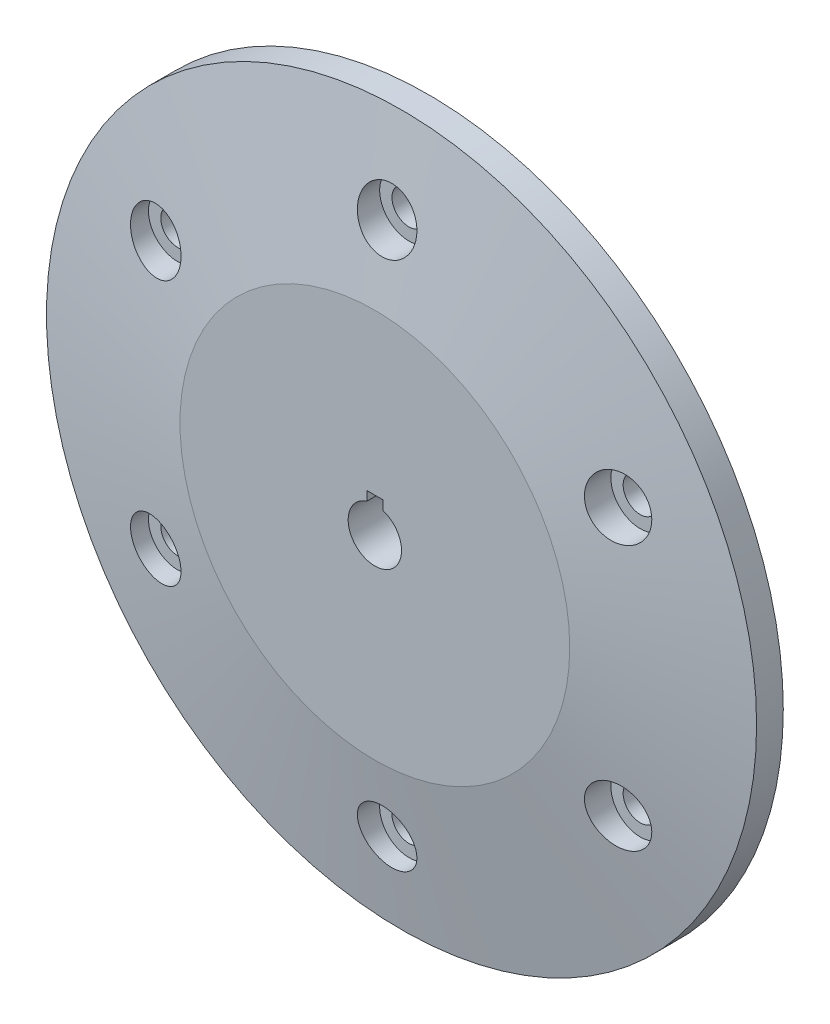
from build123d import *

# Parameters (mm, degrees)
CUT_EXTRUDE1_DEPTH                                  = 99.714234029
CHAMFER2_SIZE                                       = 5
CHAMFER2_SIZE2                                      = 30
CBORE_FOR_M6_HEX_SOCKET_HEAD_CAP_SCREW1_D           = 6.4
CBORE_FOR_M6_HEX_SOCKET_HEAD_CAP_SCREW1_CBORE_D     = 11
CBORE_FOR_M6_HEX_SOCKET_HEAD_CAP_SCREW1_CBORE_DEPTH = 6.4
CIRPATTERN1_COUNT                                   = 6


with BuildPart() as part:
    # Sketch1 → Revolve1 (revolve)
    with BuildSketch(Plane(origin=(0, 0, 0), x_dir=(1, 0, 0), z_dir=(0, 1, 0))):
        Polygon((0, 0), (0, -30), (66.5, -30), (66.5, -20), (44.8, -20), (44.8, -17), (42.8, -17), (42.8, -24), (30, -24), (30, -25), (15, -25), (15, 0), align=None)
    revolve(axis=Axis((0, 0, 30), (0, 0, -1)))

    # Sketch2 → Cut-Extrude1 (cut, through all)
    with BuildSketch(Plane(origin=(0, 0, 0), x_dir=(-1, 0, 0), z_dir=(0, 0, -1))):
        with BuildLine():
            Line((-1.5, 6.5), (-1.5, 4.769696007))
            ThreePointArc((-1.5, 4.769696007), (0, 5), (1.5, 4.769696007))
            Line((1.5, 4.769696007), (1.5, 6.5))
            Line((1.5, 6.5), (-1.5, 6.5))
        make_face()
        with BuildLine():
            Line((-1.5, 4.769696007), (-1.5, 3.5))
            Line((-1.5, 3.5), (1.5, 3.5))
            Line((1.5, 3.5), (1.5, 4.769696007))
            ThreePointArc((1.5, 4.769696007), (0, 5), (-1.5, 4.769696007))
        make_face()
        with BuildLine():
            Line((1.5, 3.5), (-1.5, 3.5))
            Line((-1.5, 3.5), (-1.5, 4.769696007))
            ThreePointArc((-1.5, 4.769696007), (-2.958039892, -4.031128874), (5, 0))
            ThreePointArc((5, 0), (4.031128874, 2.958039892), (1.5, 4.769696007))
            Line((1.5, 4.769696007), (1.5, 3.5))
        make_face()
    extrude(amount=-CUT_EXTRUDE1_DEPTH, mode=Mode.SUBTRACT)

    # Chamfer2
    chamfer2_edges = [part.edges().sort_by_distance(p)[0] for p in [
        (-66.5, 0, 30),
    ]]
    chamfer2_side = [part.faces().sort_by_distance(p)[0] for p in [
        (-66.5, 0, 25),
    ]]
    chamfer(chamfer2_edges, length=CHAMFER2_SIZE, length2=CHAMFER2_SIZE2, reference=chamfer2_side[0])

    # CBORE for M6 Hex Socket Head Cap Screw1 (through all)
    with Locations(Plane.XY.offset(30)):
        with Locations((0, 50)):
            cbore_for_m6_hex_socket_head_cap_screw1 = CounterBoreHole(CBORE_FOR_M6_HEX_SOCKET_HEAD_CAP_SCREW1_D / 2, CBORE_FOR_M6_HEX_SOCKET_HEAD_CAP_SCREW1_CBORE_D / 2, CBORE_FOR_M6_HEX_SOCKET_HEAD_CAP_SCREW1_CBORE_DEPTH)

    # CirPattern1: CBORE for M6 Hex Socket Head Cap Screw1 ×6 about axis
    cirpattern1_axis = Axis((0, 0, 0), (0, 0, 1))
    for i in range(1, CIRPATTERN1_COUNT):
        add(cbore_for_m6_hex_socket_head_cap_screw1.rotate(cirpattern1_axis, i * 360 / CIRPATTERN1_COUNT), mode=Mode.SUBTRACT)


solid = part.part
